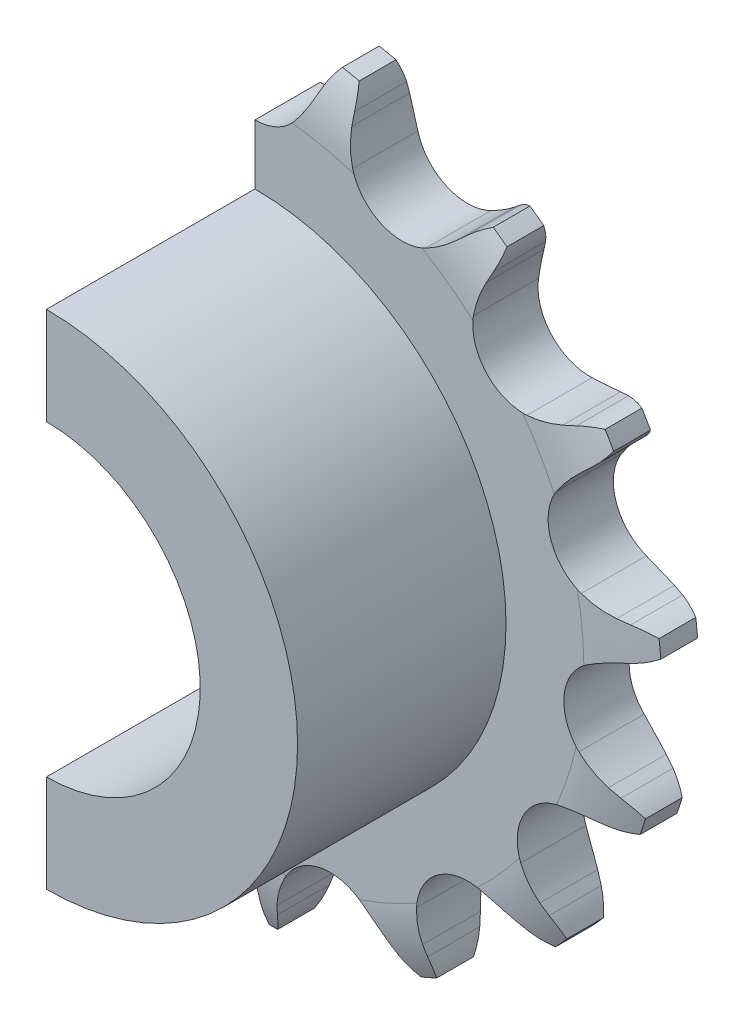
from build123d import *

# Parameters (mm, degrees)
CUT_EXTRUDE1_DEPTH       = 23.54315441
CIRPATTERN1_COUNT        = 15
BOSS_EXTRUDE1_START      = 1.3
SKETCH2_R                = 10
BOSS_EXTRUDE1_DEPTH      = 7.4
CUT_EXTRUDE2_DEPTH       = 25.083300715
CUT_EXTRUDE2_DEPTH_BACK  = 25.083300715
SKETCH3_R                = 3
SKETCH4_W                = 1.95
SKETCH4_H                = 5.584687294
CUT_EXTRUDE3_DEPTH       = 25.083300715
CUT_EXTRUDE3_DEPTH_BACK  = 25.083300715
SKETCH5_OUTSIDE_W        = 42.85
SKETCH5_OUTSIDE_H        = 42.678
SKETCH5_OUTSIDE_R        = 15.65
CUT_EXTRUDE4_DEPTH       = 24.74557098
CUT_EXTRUDE4_DEPTH_BACK  = 24.74557098
SKETCH6_R                = 10
BOSS_EXTRUDE2_DEPTH      = 8.3
BOSS_EXTRUDE2_DEPTH_BACK = 2.6
SKETCH7_R                = 10
SKETCH7_R_2              = 6.125
CUT_EXTRUDE5_DEPTH       = 25.089876321
CUT_EXTRUDE5_DEPTH_BACK  = 25.089876321
SKETCH8_W                = 18.377778724
SKETCH8_H                = 36.468875434


with BuildPart() as part:
    # Sketch1 → Revolve1 (revolve)
    with BuildSketch(Plane(origin=(0, 0, 0), x_dir=(0, 0, -1), z_dir=(1, 0, 0))):
        with BuildLine():
            Line((1.3, 0), (-1.3, 0))
            Line((-1.3, 0), (-1.3, 13.101418106))
            ThreePointArc((-1.3, 13.101418106), (-1.122370651, 14.550555781), (-0.6, 15.913890328))
            Line((-0.6, 15.913890328), (0.6, 15.913890328))
            ThreePointArc((0.6, 15.913890328), (1.122370651, 14.550555781), (1.3, 13.101418106))
            Line((1.3, 13.101418106), (1.3, 0))
        make_face()
    revolve(axis=Axis((0, 0, -1.3), (0, 0, 1)))

    # Sketch0 → Cut-Extrude1 (cut, symmetric)
    with BuildSketch(Plane.XY):
        with BuildLine():
            Line((5.458731892, -13.819129077), (5.192148114, -13.461913404))
            ThreePointArc((5.192148114, -13.461913404), (4.769815507, -12.963915887), (4.288911093, -12.522217685))
            ThreePointArc((4.288911093, -12.522217685), (2.574176066, -12.110546227), (1.175129538, -13.184072386))
            ThreePointArc((1.175129538, -13.184072386), (0.915456339, -13.78318522), (0.732190143, -14.409906736))
            Line((0.732190143, -14.409906736), (0.633946447, -14.844668882))
            ThreePointArc((0.633946447, -14.844668882), (-0.774190712, -16.881356201), (-3.200657759, -17.374512534))
            ThreePointArc((-3.200657759, -17.374512534), (3.673146461, -17.280795438), (9.99079726, -14.570582212))
            ThreePointArc((9.99079726, -14.570582212), (7.573524561, -15.106994545), (5.458731892, -13.819129077))
        make_face()
    cut_extrude1 = extrude(amount=CUT_EXTRUDE1_DEPTH, both=True, mode=Mode.SUBTRACT)

    # CirPattern1: Cut-Extrude1 ×15 about axis
    cirpattern1_axis = Axis((0, 0, 0), (0, 0, 1))
    for i in range(1, CIRPATTERN1_COUNT):
        add(cut_extrude1.rotate(cirpattern1_axis, i * 360 / CIRPATTERN1_COUNT), mode=Mode.SUBTRACT)

    # Sketch2 → Boss-Extrude1 (add)
    with BuildSketch(Plane.XY.offset(BOSS_EXTRUDE1_START)):
        with Locations(Location((0, 0, 0), (0, 0, 270))):
            Circle(SKETCH2_R)
    extrude(amount=BOSS_EXTRUDE1_DEPTH)

    # Sketch3 → Cut-Extrude2 (cut, two sides: drawn at the far end of the back side and taken through both)
    with BuildSketch(Plane.XY.offset(-CUT_EXTRUDE2_DEPTH_BACK)):
        Circle(SKETCH3_R)
    extrude(amount=CUT_EXTRUDE2_DEPTH + CUT_EXTRUDE2_DEPTH_BACK, mode=Mode.SUBTRACT)

    # Sketch4 → Cut-Revolve1 (revolve, cut)
    with BuildSketch(Plane(origin=(0, 0, 0), x_dir=(0, 0, -1), z_dir=(1, 0, 0))):
        Polygon((-8.7, 10), (-8.7, 9.5), (-8.2, 10), align=None)
        with Locations((-2.275, 13.121546681)):
            Rectangle(SKETCH4_W, SKETCH4_H)
    revolve(axis=Axis((0, 0, -1.3), (0, 0, 1)), mode=Mode.SUBTRACT)

    # Sketch5 outside → Cut-Extrude3 (cut, two sides: drawn at the far end of the back side and taken through both)
    with BuildSketch(Plane.XY.offset(-CUT_EXTRUDE3_DEPTH_BACK)):
        with Locations((0, -0.155)):
            Rectangle(SKETCH5_OUTSIDE_W, SKETCH5_OUTSIDE_H)
        Circle(SKETCH5_OUTSIDE_R, mode=Mode.SUBTRACT)
    extrude(amount=CUT_EXTRUDE3_DEPTH + CUT_EXTRUDE3_DEPTH_BACK, mode=Mode.SUBTRACT)

    # Sketch6 → Cut-Extrude4 (cut, two sides: drawn at the far end of the back side and taken through both)
    with BuildSketch(Plane.XY.offset(-CUT_EXTRUDE4_DEPTH_BACK)):
        Circle(SKETCH6_R)
    extrude(amount=CUT_EXTRUDE4_DEPTH + CUT_EXTRUDE4_DEPTH_BACK, mode=Mode.SUBTRACT)

    # Sketch7 → Boss-Extrude2 (add, two sides: drawn at the far end of the back side and taken through both)
    with BuildSketch(Plane.XY.offset(1.3).offset(-BOSS_EXTRUDE2_DEPTH_BACK)):
        Circle(SKETCH7_R)
        Circle(SKETCH7_R_2, mode=Mode.SUBTRACT)
    extrude(amount=BOSS_EXTRUDE2_DEPTH + BOSS_EXTRUDE2_DEPTH_BACK)

    # Sketch8 → Cut-Extrude5 (cut, two sides: drawn at the far end of the back side and taken through both)
    with BuildSketch(Plane.XY.offset(-CUT_EXTRUDE5_DEPTH_BACK)):
        with Locations((-9.188889362, 0.142603351)):
            Rectangle(SKETCH8_W, SKETCH8_H)
    extrude(amount=CUT_EXTRUDE5_DEPTH + CUT_EXTRUDE5_DEPTH_BACK, mode=Mode.SUBTRACT)


solid = part.part
